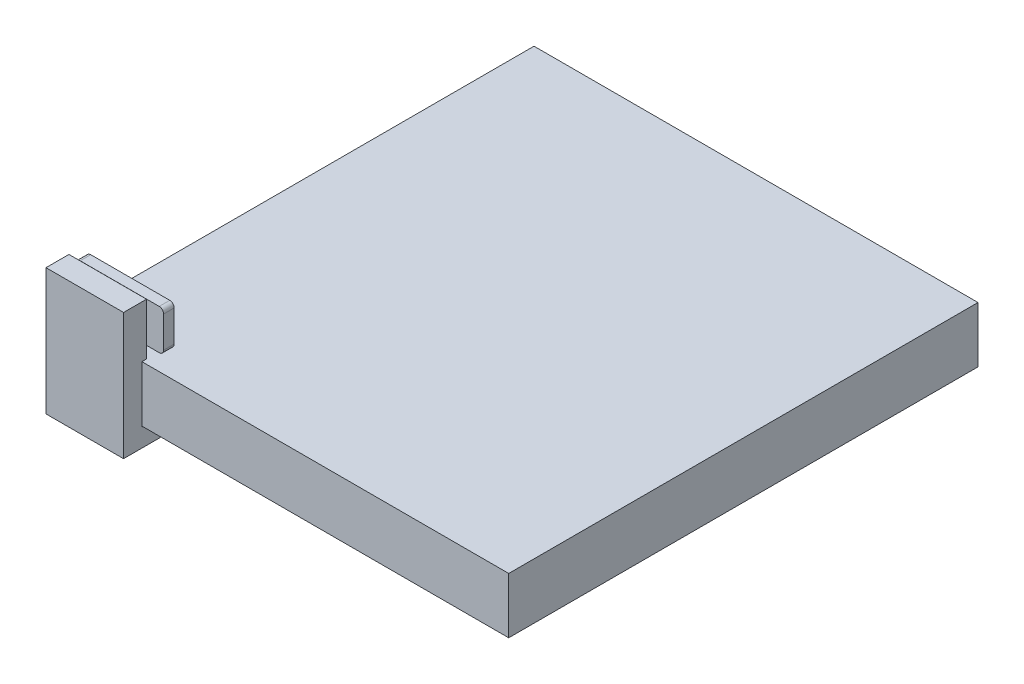
from build123d import *

# Parameters (mm, degrees)
SKETCH1_W            = 303.387938005
SKETCH1_H            = 320.675
BOSS_EXTRUDE1_DEPTH  = 38.1
BOSS_EXTRUDE2_DEPTH  = 53
BOSS_EXTRUDE4_START  = -2.875
SKETCH2_R            = 8.35
SKETCH2_R_2          = 7.5
BOSS_EXTRUDE4_DEPTH  = 12.5
SKETCH4_W            = 7.5
SKETCH4_H            = 2.85
CUT_EXTRUDE1_DEPTH   = 411.021200822
BOSS_EXTRUDE11_DEPTH = 7.2
CUT_EXTRUDE2_DEPTH   = 3


with BuildPart() as part:
    # Sketch1 → Boss-Extrude1 (new body)
    with BuildSketch(Plane(origin=(0, 0, 0), x_dir=(1, 0, 0), z_dir=(0, 1, 0))):
        with Locations((151.693969003, 160.3375)):
            Rectangle(SKETCH1_W, SKETCH1_H)
    extrude(amount=-BOSS_EXTRUDE1_DEPTH)


with BuildPart() as body_2:
    # Sketch3 → Boss-Extrude2 (new body)
    with BuildSketch(Plane(origin=(0, 0, 0), x_dir=(0, 0, -1), z_dir=(1, 0, 0))):
        Polygon((24.7, -38.4), (-0.3, -38.4), (-0.3, 0.3), (2.875, 0.3), (2.875, 35.661425503), (-0.3, 35.661425503), (-12.8, 35.661425503), (-12.8, -50.9), (24.7, -50.9), align=None)
    extrude(amount=BOSS_EXTRUDE2_DEPTH)

    # Sketch2 → Boss-Extrude4 (add)
    with BuildSketch(Plane.XY.offset(BOSS_EXTRUDE4_START)):
        with Locations(Location((14.575, 20.35, 0), (0, 0, 270))):
            Circle(SKETCH2_R)
        with Locations(Location((38.425, 19.5, 0), (0, 0, 270))):
            Circle(SKETCH2_R_2)
    extrude(amount=-BOSS_EXTRUDE4_DEPTH)

    # Sketch4 → Cut-Extrude1 (cut, through all)
    with BuildSketch(Plane(origin=(53, 0, 0), x_dir=(0, 0, -1), z_dir=(1, 0, 0))):
        with Locations((8.325, 27.275)):
            Rectangle(SKETCH4_W, SKETCH4_H)
        with Locations((8.325, 13.425)):
            Rectangle(SKETCH4_W, SKETCH4_H)
    extrude(amount=-CUT_EXTRUDE1_DEPTH, mode=Mode.SUBTRACT)


with BuildPart() as body_3:
    # Sketch5 → Boss-Extrude11 (new body)
    with BuildSketch(Plane(origin=(0, 0, -4.575), x_dir=(-1, 0, 0), z_dir=(0, 0, -1))):
        with BuildLine():
            Line((-42.078423052, 26.05), (-34.771576948, 26.05))
            ThreePointArc((-34.771576948, 26.05), (-38.425, 27), (-42.078423052, 26.05))
        make_face()
        with BuildLine():
            ThreePointArc((-60, 34.05), (-62.121320344, 33.171320344), (-63, 31.05))
            Line((-63, 31.05), (-63, 25.125357932))
            Line((-63, 25.125357932), (-63, 11.495995523))
            Line((-63, 11.495995523), (-63, 9.65))
            ThreePointArc((-63, 9.65), (-62.121320344, 7.528679656), (-60, 6.65))
            Line((-60, 6.65), (-6, 6.65))
            ThreePointArc((-6, 6.65), (-3.878679656, 7.528679656), (-3, 9.65))
            Line((-3, 9.65), (-3, 11.65))
            ThreePointArc((-3, 11.65), (-3.878679656, 13.771320344), (-6, 14.65))
            Line((-6, 14.65), (-43.425, 14.65))
            ThreePointArc((-43.425, 14.65), (-45.546320344, 15.528679656), (-46.425, 17.65))
            Line((-46.425, 17.65), (-46.425, 23.05))
            ThreePointArc((-46.425, 23.05), (-45.546320344, 25.171320344), (-43.425, 26.05))
            Line((-43.425, 26.05), (-42.078423052, 26.05))
            ThreePointArc((-42.078423052, 26.05), (-38.425, 27), (-34.771576948, 26.05))
            Line((-34.771576948, 26.05), (-6, 26.05))
            ThreePointArc((-6, 26.05), (-3.878679656, 26.928679656), (-3, 29.05))
            Line((-3, 29.05), (-3, 31.05))
            ThreePointArc((-3, 31.05), (-3.878679656, 33.171320344), (-6, 34.05))
            Line((-6, 34.05), (-60, 34.05))
        make_face()
    extrude(amount=BOSS_EXTRUDE11_DEPTH)

    # Sketch6 → Cut-Extrude2 (cut)
    with BuildSketch(Plane(origin=(0, 0, -11.775), x_dir=(-1, 0, 0), z_dir=(0, 0, -1))):
        with BuildLine():
            Line((-51, 26.35), (-51, 14.35))
            ThreePointArc((-51, 14.35), (-55, 10.35), (-59, 14.35))
            Line((-59, 14.35), (-59, 26.35))
            ThreePointArc((-59, 26.35), (-55, 30.35), (-51, 26.35))
        make_face()
    extrude(amount=-CUT_EXTRUDE2_DEPTH, mode=Mode.SUBTRACT)


solid = Compound([part.part, body_2.part, body_3.part])
